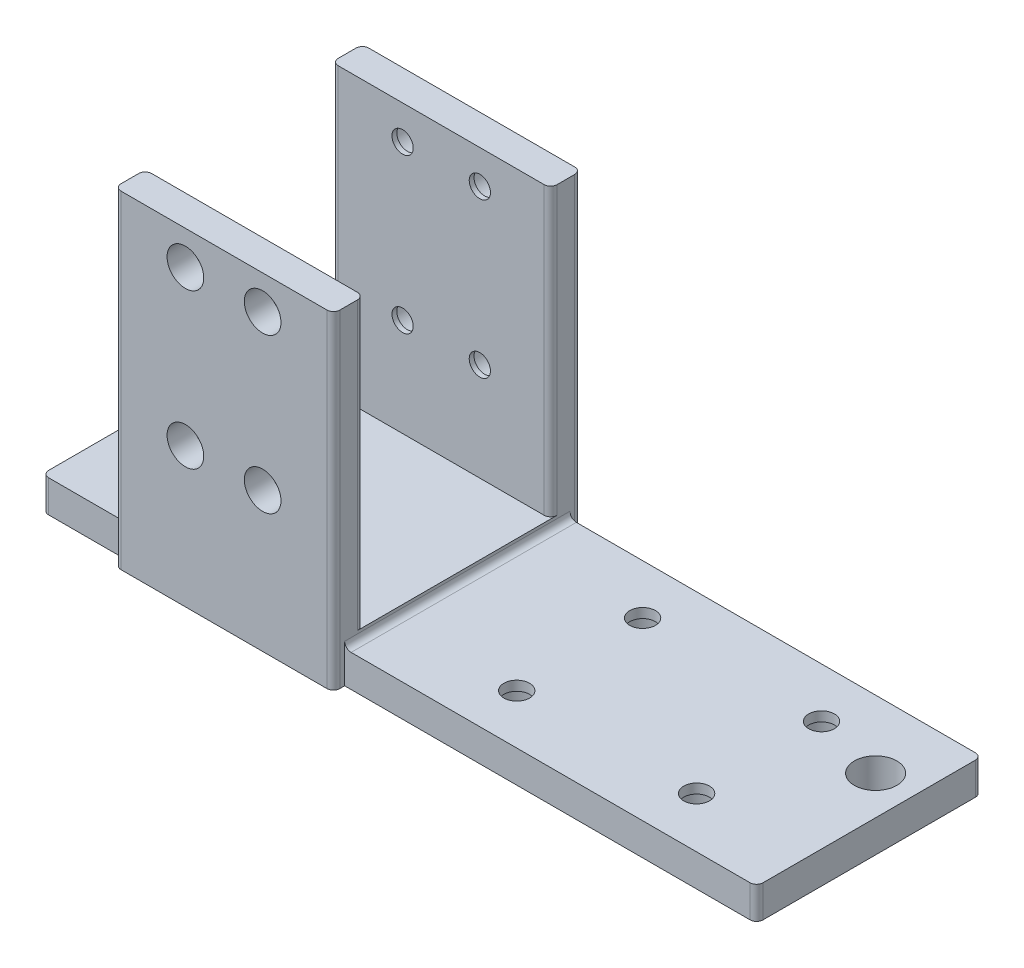
from build123d import *

# Parameters (mm, degrees)
SKETCH1_W                                      = 105
SKETCH1_H                                      = 35
BOSS_EXTRUDE1_DEPTH                            = 5
SKETCH4_W                                      = 33.2
SKETCH4_H                                      = 35
BOSS_EXTRUDE2_DEPTH                            = 1.45
BOSS_EXTRUDE3_DEPTH                            = 17
CBORE_FOR_M2_5_SHCS1_AT_2_COUNT                = 2
CBORE_FOR_M2_5_SHCS1_AT_2_PITCH                = 12
CBORE_FOR_M2_5_SHCS1_AT_3_COUNT                = 2
CBORE_FOR_M2_5_SHCS1_AT_3_PITCH                = 24
CBORE_FOR_M2_5_SHCS1_AT_4_COUNT                = 2
CBORE_FOR_M2_5_SHCS1_AT_4_PITCH                = 26.83281573
BOSS_EXTRUDE5_DEPTH                            = 0.4
BOSS_EXTRUDE6_DEPTH                            = 0.4
CBORE_FOR_6_SOCKET_HEAD_CAP_SCREW1_D           = 3.997300108
CBORE_FOR_6_SOCKET_HEAD_CAP_SCREW1_CBORE_D     = 7.345020108
CBORE_FOR_6_SOCKET_HEAD_CAP_SCREW1_CBORE_DEPTH = 3.5052
SKETCH15_W                                     = 34
SKETCH15_H                                     = 44.5
CUT_EXTRUDE1_DEPTH                             = 14.5
SKETCH16_W                                     = 35
SKETCH16_H                                     = 5
BOSS_EXTRUDE7_DEPTH                            = 2
SKETCH17_W                                     = 35
SKETCH17_H                                     = 5
BOSS_EXTRUDE8_DEPTH                            = 4
M6_CLEARANCE_HOLE1_D                           = 6.6
FILLET1_R                                      = 1


with BuildPart() as part:
    # Sketch1 → Boss-Extrude1 (new body)
    with BuildSketch(Plane(origin=(0, 0, 0), x_dir=(1, 0, 0), z_dir=(0, 1, 0))):
        Rectangle(SKETCH1_W, SKETCH1_H)
    extrude(amount=BOSS_EXTRUDE1_DEPTH)

    # Sketch4 → Boss-Extrude2 (add)
    with BuildSketch(Plane(origin=(0, 5, 0), x_dir=(1, 0, 0), z_dir=(0, 1, 0))):
        with Locations((-24.5, 0)):
            Rectangle(SKETCH4_W, SKETCH4_H)
    extrude(amount=BOSS_EXTRUDE2_DEPTH)

    # Sketch5 → Boss-Extrude3 (add, symmetric)
    with BuildSketch(Plane.ZY.offset(24.5)):
        Polygon((-17.5, 0), (-19.25, 0), (-19.25, 50.95), (-14.25, 50.95), (-14.25, 6.45), (-17.5, 6.45), align=None)
    boss_extrude3 = extrude(amount=BOSS_EXTRUDE3_DEPTH, both=True)

    # Sketch9 → CBORE for M2.5 SHCS1 (revolve, cut)
    with BuildSketch(Plane(origin=(-30.5, 45.7, -19.25), x_dir=(0, 1, 0), z_dir=(1, 0, 0))):
        Polygon((0, 0), (0, 34.490420021), (1.65, 33.499), (1.65, 4), (2.85, 4), (2.85, 0), align=None)
    cbore_for_m2_5_shcs1 = revolve(axis=Axis((-30.5, 45.7, -25.6), (0, 0, 1)), mode=Mode.SUBTRACT)

    # CBORE for M2.5 SHCS1 at 2: CBORE for M2.5 SHCS1 ×2
    with Locations(*[(i * CBORE_FOR_M2_5_SHCS1_AT_2_PITCH, 0, 0) for i in range(1, CBORE_FOR_M2_5_SHCS1_AT_2_COUNT)]):
        add(cbore_for_m2_5_shcs1, mode=Mode.SUBTRACT)

    # CBORE for M2.5 SHCS1 at 3: CBORE for M2.5 SHCS1 ×2
    with Locations(*[(0, -i * CBORE_FOR_M2_5_SHCS1_AT_3_PITCH, 0) for i in range(1, CBORE_FOR_M2_5_SHCS1_AT_3_COUNT)]):
        add(cbore_for_m2_5_shcs1, mode=Mode.SUBTRACT)

    # CBORE for M2.5 SHCS1 at 4: CBORE for M2.5 SHCS1 ×2
    with Locations(*[Vector(0.44721359549995815, -0.8944271909999159, 0) * (i * CBORE_FOR_M2_5_SHCS1_AT_4_PITCH) for i in range(1, CBORE_FOR_M2_5_SHCS1_AT_4_COUNT)]):
        add(cbore_for_m2_5_shcs1, mode=Mode.SUBTRACT)

    # Mirror1: Boss-Extrude3, CBORE for M2.5 SHCS1 across plane
    add(boss_extrude3.mirror(Plane(origin=(0, 0, 0), x_dir=(1, 0, 0), z_dir=(0, 0, -1))))
    add(cbore_for_m2_5_shcs1.mirror(Plane(origin=(0, 0, 0), x_dir=(1, 0, 0), z_dir=(0, 0, -1))), mode=Mode.SUBTRACT)

    # Mirror1 copy 1 sketch → Mirror1 copy 1 (revolve, cut)
    with BuildSketch(Plane(origin=(-18.5, 45.7, 19.25), x_dir=(0, 1, 0), z_dir=(1, 0, 0))):
        Polygon((0, 0), (0, -34.490420021), (1.65, -33.499), (1.65, -4), (2.85, -4), (2.85, 0), align=None)
    revolve(axis=Axis((-18.5, 45.7, 25.6), (0, 0, 1)), mode=Mode.SUBTRACT)

    # Mirror1 copy 2 sketch → Mirror1 copy 2 (revolve, cut)
    with BuildSketch(Plane(origin=(-30.5, 21.7, 19.25), x_dir=(0, 1, 0), z_dir=(1, 0, 0))):
        Polygon((0, 0), (0, -34.490420021), (1.65, -33.499), (1.65, -4), (2.85, -4), (2.85, 0), align=None)
    revolve(axis=Axis((-30.5, 21.7, 25.6), (0, 0, 1)), mode=Mode.SUBTRACT)

    # Mirror1 copy 3 sketch → Mirror1 copy 3 (revolve, cut)
    with BuildSketch(Plane(origin=(-18.5, 21.7, 19.25), x_dir=(0, 1, 0), z_dir=(1, 0, 0))):
        Polygon((0, 0), (0, -34.490420021), (1.65, -33.499), (1.65, -4), (2.85, -4), (2.85, 0), align=None)
    revolve(axis=Axis((-18.5, 21.7, 25.6), (0, 0, 1)), mode=Mode.SUBTRACT)

    # Sketch11 → Boss-Extrude5 (add)
    with BuildSketch(Plane(origin=(-7.9, 0, 0), x_dir=(0, 0, -1), z_dir=(1, 0, 0))):
        Polygon((17.5, 5), (17.5, 6.45), (14.25, 6.45), (-14.25, 6.45), (-17.5, 6.45), (-17.5, 5), align=None)
    extrude(amount=BOSS_EXTRUDE5_DEPTH)

    # Sketch12 → Boss-Extrude6 (add)
    with BuildSketch(Plane.ZY.offset(41.1)):
        Polygon((17.5, 5), (17.5, 6.45), (14.25, 6.45), (-14.25, 6.45), (-17.5, 6.45), (-17.5, 5), align=None)
    extrude(amount=BOSS_EXTRUDE6_DEPTH)

    # CBORE for #6 Socket Head Cap Screw1 (through all)
    with Locations(Plane(origin=(0, 0, 0), x_dir=(-1, 0, 0), z_dir=(0, -1, 0))):
        with Locations((-39.325, 9.779), (-11.514, 9.779), (-39.325, -9.639687995), (-11.514, -9.779)):
            CounterBoreHole(CBORE_FOR_6_SOCKET_HEAD_CAP_SCREW1_D / 2, CBORE_FOR_6_SOCKET_HEAD_CAP_SCREW1_CBORE_D / 2, CBORE_FOR_6_SOCKET_HEAD_CAP_SCREW1_CBORE_DEPTH)

    # Sketch15 → Cut-Extrude1 (cut, symmetric)
    with BuildSketch(Plane(origin=(0, 0, 0), x_dir=(-1, 0, 0), z_dir=(0, 0, -1))):
        with Locations((24.5, 28.7)):
            Rectangle(SKETCH15_W, SKETCH15_H)
    extrude(amount=CUT_EXTRUDE1_DEPTH, both=True, mode=Mode.SUBTRACT)

    # Sketch16 → Boss-Extrude7 (add)
    with BuildSketch(Plane.ZY.offset(52.5)):
        with Locations((0, 2.5)):
            Rectangle(SKETCH16_W, SKETCH16_H)
    extrude(amount=BOSS_EXTRUDE7_DEPTH)

    # Sketch17 → Boss-Extrude8 (add)
    with BuildSketch(Plane(origin=(52.5, 0, 0), x_dir=(0, 0, -1), z_dir=(1, 0, 0))):
        with Locations((0, 2.5)):
            Rectangle(SKETCH17_W, SKETCH17_H)
    extrude(amount=BOSS_EXTRUDE8_DEPTH)

    # M6 Clearance Hole1 (through all)
    with Locations(Plane(origin=(0, 5, 0), x_dir=(1, 0, 0), z_dir=(0, 1, 0))):
        with Locations((-48.5, 7), (50.5, 7)):
            Hole(M6_CLEARANCE_HOLE1_D / 2)

    # Fillet1
    fillet1_edges = [part.edges().sort_by_distance(p)[0] for p in [
        (-7.5, 5, 0),
        (-41.5, 5, 0),
        (-7.5, 28.7, -14.5),
        (-41.5, 28.7, -14.5),
        (-7.5, 28.7, 14.5),
        (-41.5, 28.7, 14.5),
        (-54.5, 2.5, -17.5),
        (-54.5, 2.5, 17.5),
        (56.5, 2.5, 17.5),
        (56.5, 2.5, -17.5),
        (-41.5, 25.475, -19.25),
        (-7.5, 25.475, -19.25),
        (-41.5, 25.475, 19.25),
        (-7.5, 25.475, 19.25),
    ]]
    fillet(fillet1_edges, radius=FILLET1_R)


solid = part.part
